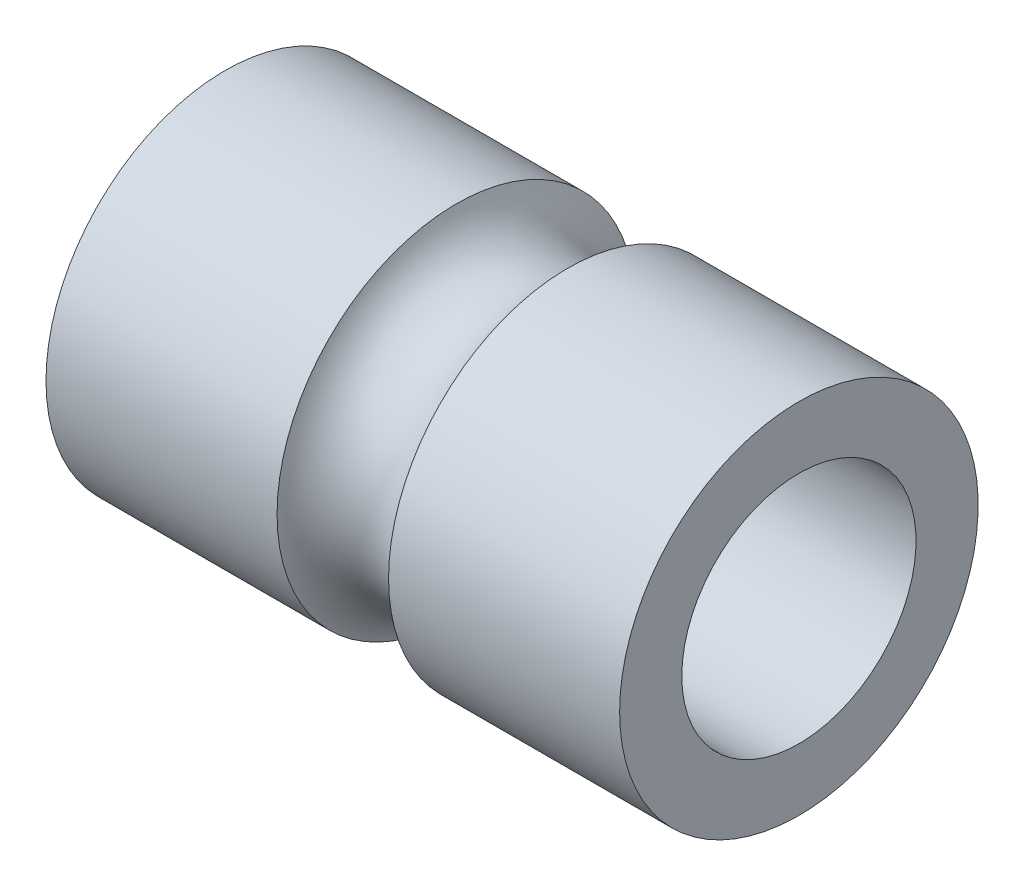
from build123d import *


with BuildPart() as part:
    # Sketch1 → Revolve4 (revolve)
    with BuildSketch(Plane.XY, mode=Mode.PRIVATE) as revolve4_sk:
        with BuildLine():
            Line((0, 2.45), (12, 2.45))
            Line((12, 2.45), (12, 3.75))
            Line((12, 3.75), (7.166190379, 3.75))
            ThreePointArc((7.166190379, 3.75), (6, 2.95), (4.833809621, 3.75))
            Line((4.833809621, 3.75), (0, 3.75))
            Line((0, 3.75), (0, 2.45))
        make_face()
    revolve(revolve4_sk.sketch.rotate(Axis((-1000, 0, 0), (1, 0, 0)), 90), axis=Axis((-1000, 0, 0), (1, 0, 0)))


solid = part.part
